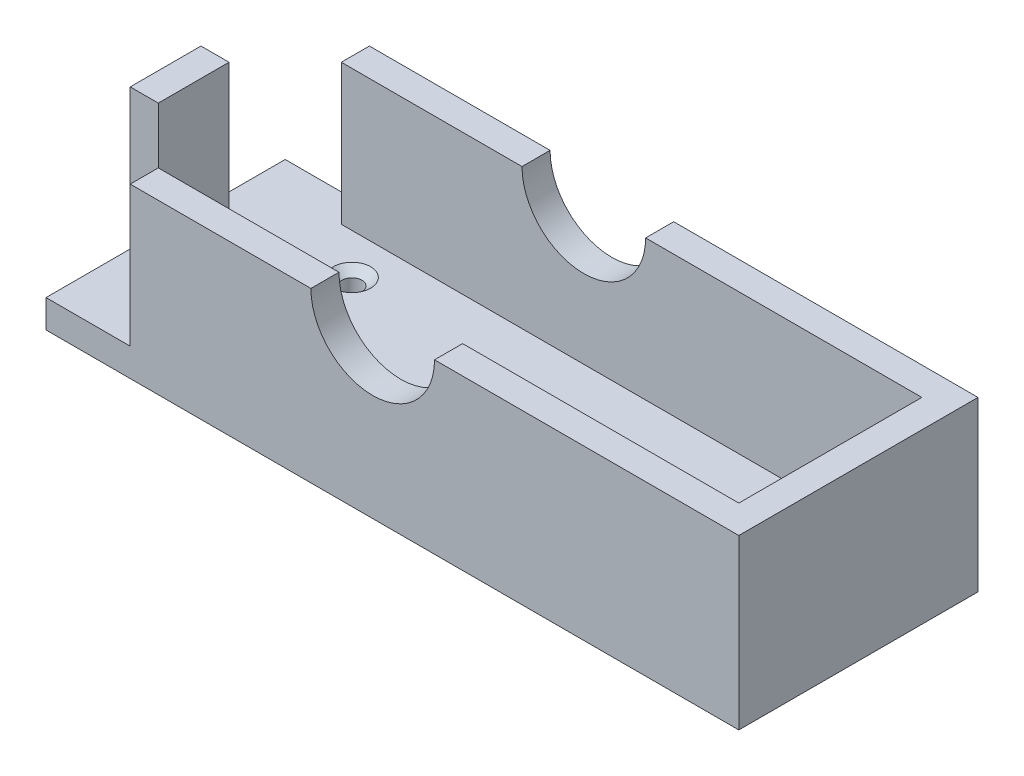
from build123d import *

# Parameters (mm, degrees)
SKETCH1_W                                         = 6.35
SKETCH1_H                                         = 16.002
BOSS_EXTRUDE1_DEPTH                               = 38.1
SKETCH1_H_2                                       = 54.102
BOSS_EXTRUDE1_2_DEPTH                             = 38.1
BOSS_EXTRUDE2_DEPTH                               = 6.35
SKETCH1_5_W                                       = 131.318
SKETCH1_5_H                                       = 6.35
BOSS_EXTRUDE3_DEPTH                               = 38.1
CSK_FOR_8_FLAT_HEAD_MACHINE_SCREW_100_D           = 4.4958
CSK_FOR_8_FLAT_HEAD_MACHINE_SCREW_100_CSINK_D     = 8.4328
CSK_FOR_8_FLAT_HEAD_MACHINE_SCREW_100_CSINK_ANGLE = 100
BOSS_EXTRUDE6_DEPTH                               = 6.35
CUT_EXTRUDE3_DEPTH                                = 105.525006773
CUT_EXTRUDE3_DEPTH_BACK                           = 105.525006773
BOSS_EXTRUDE7_DEPTH                               = 6.35


with BuildPart() as part:
    # Sketch1 → Boss-Extrude1 (new body)
    with BuildSketch(Plane(origin=(0, 0, 0), x_dir=(1, 0, 0), z_dir=(0, 1, 0))):
        with Locations((-72.630450684, -10.571178218)):
            Rectangle(SKETCH1_W, SKETCH1_H)
    extrude(amount=BOSS_EXTRUDE1_DEPTH)



with BuildPart() as body_2:
    # Sketch1 → Boss-Extrude1 2 (new body)
    with BuildSketch(Plane(origin=(0, 0, 0), x_dir=(1, 0, 0), z_dir=(0, 1, 0))):
        with Locations((77.737549316, -10.571178218)):
            Rectangle(SKETCH1_W, SKETCH1_H_2)
    extrude(amount=BOSS_EXTRUDE1_2_DEPTH)


with BuildPart() as part_1:
    add(part.part)

    add(body_2.part)  # Boss-Extrude2 merges body 2
    # Sketch1<4> → Boss-Extrude2 (add)
    with BuildSketch(Plane(origin=(0, 0, 0), x_dir=(1, 0, 0), z_dir=(0, 1, 0))):
        Polygon((-56.755450684, 10.129821782), (-69.455450684, 10.129821782), (-69.455450684, -2.570178218), (-69.455450684, -18.572178218), (-69.455450684, -31.272178218), (-56.755450684, -31.272178218), (74.562549316, -31.272178218), (74.562549316, 10.129821782), align=None)
    extrude(amount=BOSS_EXTRUDE2_DEPTH)

    # Sketch1<5> → Boss-Extrude3 (add)
    with BuildSketch(Plane(origin=(0, 0, 0), x_dir=(1, 0, 0), z_dir=(0, 1, 0))):
        with Locations((8.903549316, 13.304821782)):
            Rectangle(SKETCH1_5_W, SKETCH1_5_H)
        with Locations((8.903549316, -34.447178218)):
            Rectangle(SKETCH1_5_W, SKETCH1_5_H)
    extrude(amount=BOSS_EXTRUDE3_DEPTH)

    # CSK for #8 Flat Head Machine Screw (100)2 (through all)
    with Locations(Plane(origin=(0, 6.35, 0), x_dir=(1, 0, 0), z_dir=(0, 1, 0))):
        with Locations((-45.134950684, -21.937678218), (-45.134950684, 0.922321782), (50.115049316, 0.858821782), (50.115049316, -22.001178218)):
            CounterSinkHole(CSK_FOR_8_FLAT_HEAD_MACHINE_SCREW_100_D / 2, CSK_FOR_8_FLAT_HEAD_MACHINE_SCREW_100_CSINK_D / 2, counter_sink_angle=CSK_FOR_8_FLAT_HEAD_MACHINE_SCREW_100_CSINK_ANGLE)

    # Sketch1<8> → Boss-Extrude6 (add)
    with BuildSketch(Plane(origin=(0, 0, 0), x_dir=(1, 0, 0), z_dir=(0, 1, 0))):
        Polygon((-69.455450684, -31.272178218), (-69.455450684, -18.572178218), (-75.805450684, -18.572178218), (-75.805450684, -31.272178218), (-75.805450684, -37.622178218), (-56.755450684, -37.622178218), (-56.755450684, -31.272178218), align=None)
    extrude(amount=BOSS_EXTRUDE6_DEPTH)

    # Sketch11 → Cut-Extrude3 (cut, two sides: drawn at the far end of the back side and taken through both)
    with BuildSketch(Plane.XY.offset(37.622178218).offset(-CUT_EXTRUDE3_DEPTH_BACK)):
        with BuildLine():
            Line((-15.886355633, 256.15420447), (-15.886355633, 38.1))
            ThreePointArc((-15.886355633, 38.1), (-1.903903158, 24.117547525), (12.078549316, 38.1))
            Line((12.078549316, 38.1), (12.078549316, 256.15420447))
            Line((12.078549316, 256.15420447), (12.078549316, 692.262613411))
            Line((12.078549316, 692.262613411), (-15.886355633, 692.262613411))
            Line((-15.886355633, 692.262613411), (-15.886355633, 256.15420447))
        make_face()
    extrude(amount=CUT_EXTRUDE3_DEPTH + CUT_EXTRUDE3_DEPTH_BACK, mode=Mode.SUBTRACT)

    # Sketch1<9> → Boss-Extrude7 (add)
    with BuildSketch(Plane(origin=(0, 0, 0), x_dir=(1, 0, 0), z_dir=(0, 1, 0))):
        Polygon((-69.455450684, -2.570178218), (-69.455450684, 10.129821782), (-56.755450684, 10.129821782), (-56.755450684, 16.479821782), (-69.455450684, 16.479821782), (-75.805450684, 16.479821782), (-75.805450684, 10.129821782), (-75.805450684, -2.570178218), align=None)
    extrude(amount=BOSS_EXTRUDE7_DEPTH)


solid = part_1.part
